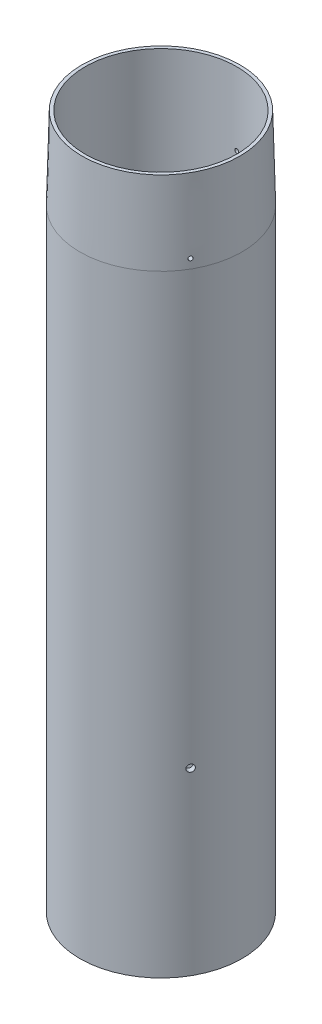
from build123d import *

# Parameters (mm, degrees)
SKETCH1_R                    = 40.8178
SKETCH1_R_2                  = 38.1508
BOSS_EXTRUDE1_DEPTH          = 349.25
SANDING_CHAMFER_SIZE         = 41.275
SANDING_CHAMFER_SIZE2        = 1.044780796
AIRFRAME_BOLT_CUT_REACH      = 364.665
AIRFRAME_BOLT_CUT_END_RADIUS = 38.1508
SKETCH2_R                    = 1.778
AIRFRAME_BOLT_PATTERN_COUNT  = 3
SHEAR_PIN_CUT_REACH          = 364.665
SHEAR_PIN_CUT_END_RADIUS     = 38.1508
SKETCH3_R                    = 0.9906
SHEAR_PIN_PATTERN_COUNT      = 3


with BuildPart() as part:
    # Sketch1 → Boss-Extrude1 (new body)
    with BuildSketch(Plane(origin=(0, 0, 0), x_dir=(1, 0, 0), z_dir=(0, 1, 0))):
        with Locations(Location((0, 0, 0), (0, 0, 270))):
            Circle(SKETCH1_R)
        with Locations(Location((0, 0, 0), (0, 0, 270))):
            Circle(SKETCH1_R_2, mode=Mode.SUBTRACT)
    extrude(amount=BOSS_EXTRUDE1_DEPTH)

    # Sanding Chamfer
    sanding_chamfer_edges = [part.edges().sort_by_distance(p)[0] for p in [
        (0, 349.25, -40.8178),
    ]]
    sanding_chamfer_side = [part.faces().sort_by_distance(p)[0] for p in [
        (0, 174.625, -40.8178),
    ]]
    chamfer(sanding_chamfer_edges, length=SANDING_CHAMFER_SIZE, length2=SANDING_CHAMFER_SIZE2, reference=sanding_chamfer_side[0])

    # Airframe Bolt Cut: up to this cylinder (the profile starts outside it)
    airframe_bolt_cut_end = Plane(origin=(0, 90.4875, 0), z_dir=(0, -1, 0)) * Cylinder(AIRFRAME_BOLT_CUT_END_RADIUS, 806.6316, mode=Mode.PRIVATE)
    # Sketch2 → Airframe Bolt Cut (cut, up to the surface)
    with BuildSketch(Plane(origin=(35.349251727, 0, 20.4089), x_dir=(0, -1, 0), z_dir=(0.866025403784438, 0, 0.500000000000001)), mode=Mode.PRIVATE) as airframe_bolt_cut_sk1:
        with Locations(Location((-90.4875, 0, 0), (0, 0, 90))):
            Circle(SKETCH2_R)
    airframe_bolt_cut_tool1 = extrude(airframe_bolt_cut_sk1.sketch, amount=-AIRFRAME_BOLT_CUT_REACH, mode=Mode.PRIVATE) - airframe_bolt_cut_end
    airframe_bolt_cut = airframe_bolt_cut_tool1.solids().sort_by_distance((35.349252, 90.4875, 20.4089))[0]
    add(airframe_bolt_cut, mode=Mode.SUBTRACT)

    # Airframe Bolt Pattern: Airframe Bolt Cut ×3 about axis
    airframe_bolt_pattern_axis = Axis((0, -55, 0), (0, 1, 0))
    for i in range(1, AIRFRAME_BOLT_PATTERN_COUNT):
        add(airframe_bolt_cut.rotate(airframe_bolt_pattern_axis, i * 360 / AIRFRAME_BOLT_PATTERN_COUNT), mode=Mode.SUBTRACT)

    # Shear Pin Cut: up to this cylinder (the profile starts outside it)
    shear_pin_cut_end = Plane(origin=(0, 312.5216, 0), z_dir=(0, -1, 0)) * Cylinder(SHEAR_PIN_CUT_END_RADIUS, 806.6316, mode=Mode.PRIVATE)
    # Sketch3 → Shear Pin Cut (cut, up to the surface)
    with BuildSketch(Plane(origin=(35.349251727, 0, 20.4089), x_dir=(0, -1, 0), z_dir=(0.866025403784438, 0, 0.500000000000001)), mode=Mode.PRIVATE) as shear_pin_cut_sk1:
        with Locations(Location((-312.5216, 0, 0), (0, 0, 90))):
            Circle(SKETCH3_R)
    shear_pin_cut_tool1 = extrude(shear_pin_cut_sk1.sketch, amount=-SHEAR_PIN_CUT_REACH, mode=Mode.PRIVATE) - shear_pin_cut_end
    shear_pin_cut = shear_pin_cut_tool1.solids().sort_by_distance((35.349252, 312.5216, 20.4089))[0]
    add(shear_pin_cut, mode=Mode.SUBTRACT)

    # Shear Pin Pattern: Shear Pin Cut ×3 about axis
    shear_pin_pattern_axis = Axis((0, -55, 0), (0, 1, 0))
    for i in range(1, SHEAR_PIN_PATTERN_COUNT):
        add(shear_pin_cut.rotate(shear_pin_pattern_axis, i * 360 / SHEAR_PIN_PATTERN_COUNT), mode=Mode.SUBTRACT)


solid = part.part
